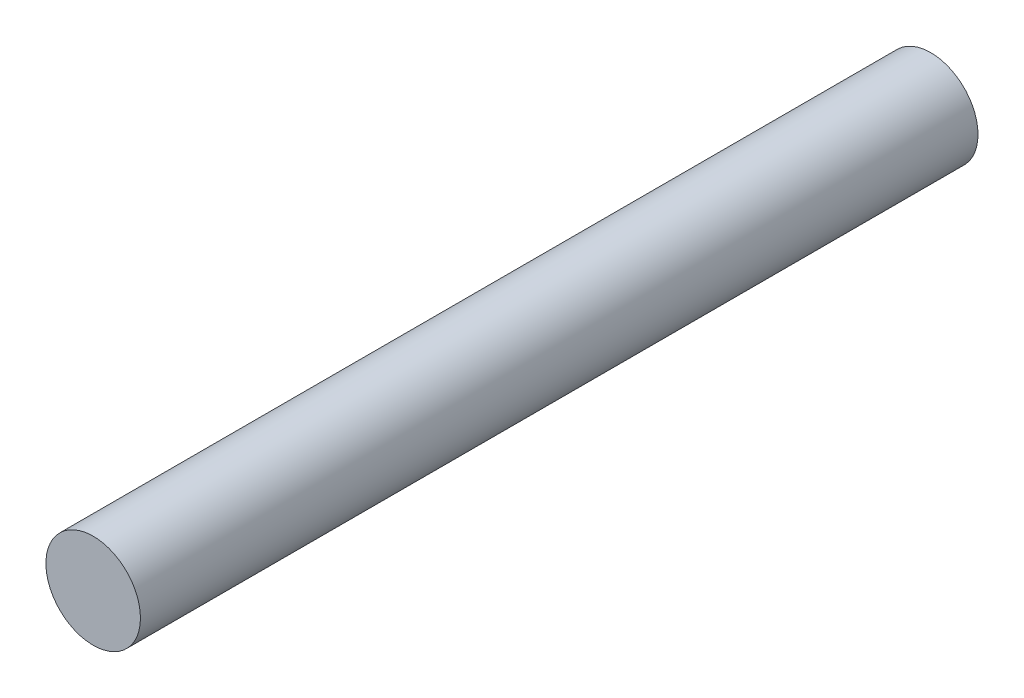
from build123d import *

# Parameters (mm, degrees)
SKETCH1_R           = 2.5
BOSS_EXTRUDE1_DEPTH = 44.3


with BuildPart() as part:
    # Sketch1 → Boss-Extrude1 (new body)
    with BuildSketch(Plane.XY):
        Circle(SKETCH1_R)
    extrude(amount=BOSS_EXTRUDE1_DEPTH)


solid = part.part
